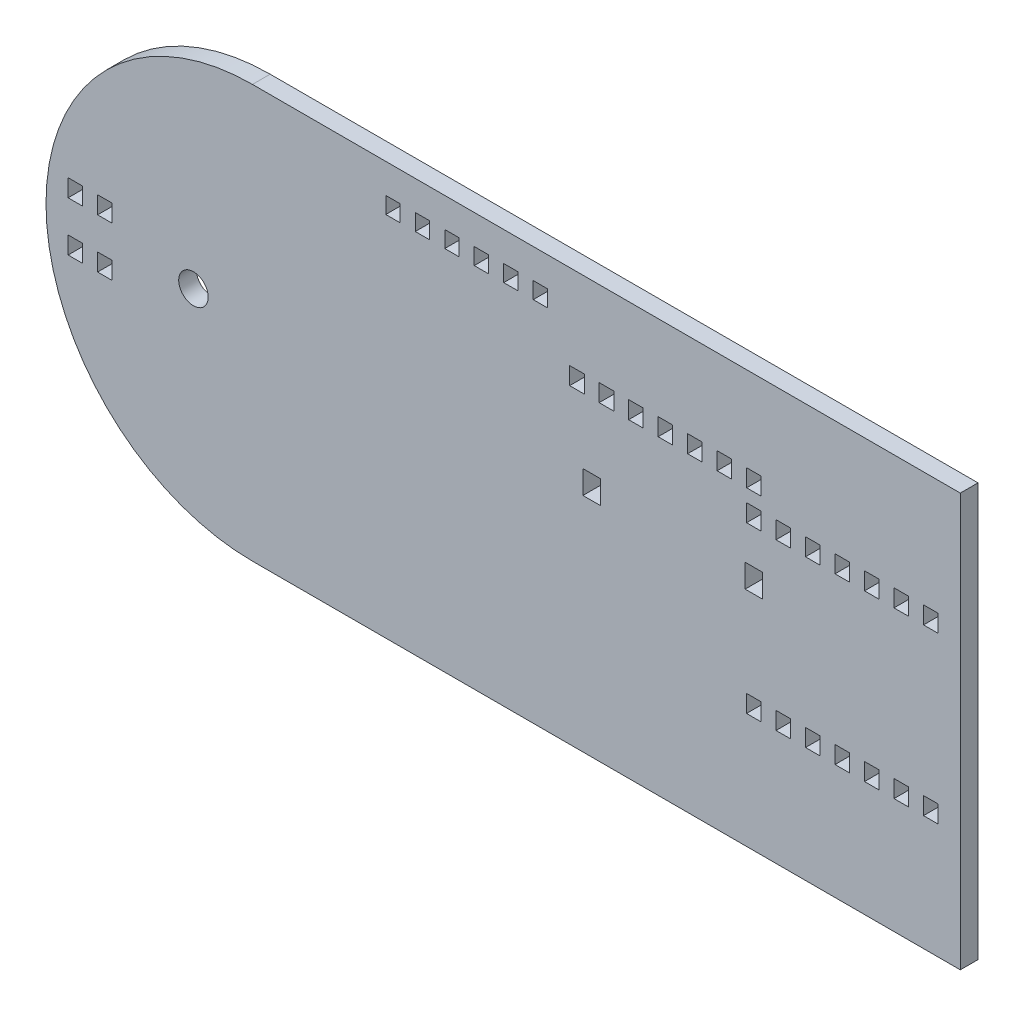
from build123d import *

# Parameters (mm, degrees)
ESQUISSE1_W             = 310
ESQUISSE1_H             = 140
BOSS_EXTRU_1_DEPTH      = 6
ESQUISSE4_W             = 4.95
ESQUISSE4_H             = 5.9
ESQUISSE4_W_2           = 5.9
ESQUISSE4_H_2           = 7.9
ENL_V_MAT_EXTRU_3_DEPTH = 6
ESQUISSE5_W             = 4.95
ESQUISSE5_H             = 5.9
ENL_V_MAT_EXTRU_4_DEPTH = 6
ESQUISSE6_W             = 4.95
ESQUISSE6_H             = 5.9
ENL_V_MAT_EXTRU_5_DEPTH = 6
ENL_V_MAT_EXTRU_6_DEPTH = 6
ESQUISSE8_R             = 5
ENL_V_MAT_EXTRU_7_DEPTH = 6
ESQUISSE9_W             = 4.8
ESQUISSE9_H             = 5.6
ENL_V_MAT_EXTRU_8_DEPTH = 10


with BuildPart() as part:
    # Esquisse1 → Boss.-Extru.1 (new body)
    with BuildSketch(Plane.XY):
        with Locations((155, 70)):
            Rectangle(ESQUISSE1_W, ESQUISSE1_H)
    extrude(amount=BOSS_EXTRU_1_DEPTH)

    # Esquisse4 → Enlèv. mat.-Extru.3 (cut)
    with BuildSketch(Plane.XY.offset(6)):
        with Locations((190.025, 108.27)):
            Rectangle(ESQUISSE4_W, ESQUISSE4_H)
        with Locations((185, 79.27)):
            Rectangle(ESQUISSE4_W_2, ESQUISSE4_H_2)
        with Locations((240, 79.27)):
            Rectangle(ESQUISSE4_W_2, ESQUISSE4_H_2)
        with Locations((180.025, 108.27)):
            Rectangle(ESQUISSE4_W, ESQUISSE4_H)
        with Locations((200.025, 108.27)):
            Rectangle(ESQUISSE4_W, ESQUISSE4_H)
        with Locations((210.025, 108.27)):
            Rectangle(ESQUISSE4_W, ESQUISSE4_H)
        with Locations((220.025, 108.27)):
            Rectangle(ESQUISSE4_W, ESQUISSE4_H)
        with Locations((230.025, 108.27)):
            Rectangle(ESQUISSE4_W, ESQUISSE4_H)
        with Locations((240.025, 108.27)):
            Rectangle(ESQUISSE4_W, ESQUISSE4_H)
    extrude(amount=-ENL_V_MAT_EXTRU_3_DEPTH, mode=Mode.SUBTRACT)

    # Esquisse5 → Enlèv. mat.-Extru.4 (cut)
    with BuildSketch(Plane(origin=(0, 0, 0), x_dir=(-1, 0, 0), z_dir=(0, 0, -1))):
        with Locations((-300, 98)):
            Rectangle(ESQUISSE5_W, ESQUISSE5_H)
        with Locations((-290, 98)):
            Rectangle(ESQUISSE5_W, ESQUISSE5_H)
        with Locations((-280, 98)):
            Rectangle(ESQUISSE5_W, ESQUISSE5_H)
        with Locations((-270, 98)):
            Rectangle(ESQUISSE5_W, ESQUISSE5_H)
        with Locations((-260, 98)):
            Rectangle(ESQUISSE5_W, ESQUISSE5_H)
        with Locations((-250, 98)):
            Rectangle(ESQUISSE5_W, ESQUISSE5_H)
        with Locations((-240, 98)):
            Rectangle(ESQUISSE5_W, ESQUISSE5_H)
        with Locations((-240, 42)):
            Rectangle(ESQUISSE5_W, ESQUISSE5_H)
        with Locations((-250, 42)):
            Rectangle(ESQUISSE5_W, ESQUISSE5_H)
        with Locations((-260, 42)):
            Rectangle(ESQUISSE5_W, ESQUISSE5_H)
        with Locations((-270, 42)):
            Rectangle(ESQUISSE5_W, ESQUISSE5_H)
        with Locations((-280, 42)):
            Rectangle(ESQUISSE5_W, ESQUISSE5_H)
        with Locations((-300, 42)):
            Rectangle(ESQUISSE5_W, ESQUISSE5_H)
        with Locations((-290, 42)):
            Rectangle(ESQUISSE5_W, ESQUISSE5_H)
    extrude(amount=-ENL_V_MAT_EXTRU_4_DEPTH, mode=Mode.SUBTRACT)

    # Esquisse6 → Enlèv. mat.-Extru.5 (cut)
    with BuildSketch(Plane(origin=(0, 0, 0), x_dir=(-1, 0, 0), z_dir=(0, 0, -1))):
        with Locations((-9.975, 78.4)):
            Rectangle(ESQUISSE6_W, ESQUISSE6_H)
        with Locations((-19.975, 78.4)):
            Rectangle(ESQUISSE6_W, ESQUISSE6_H)
        with Locations((-9.975, 61.6)):
            Rectangle(ESQUISSE6_W, ESQUISSE6_H)
        with Locations((-19.975, 61.6)):
            Rectangle(ESQUISSE6_W, ESQUISSE6_H)
    extrude(amount=-ENL_V_MAT_EXTRU_5_DEPTH, mode=Mode.SUBTRACT)

    # Esquisse7 → Enlèv. mat.-Extru.6 (cut)
    with BuildSketch(Plane(origin=(0, 0, 0), x_dir=(-1, 0, 0), z_dir=(0, 0, -1))):
        with BuildLine():
            Line((-70, 140), (0, 140))
            Line((0, 140), (30, 140))
            Line((30, 140), (30, 0))
            Line((30, 0), (0, 0))
            Line((0, 0), (-70, 0))
            ThreePointArc((-70, 0), (0, 70), (-70, 140))
        make_face()
    extrude(amount=-ENL_V_MAT_EXTRU_6_DEPTH, mode=Mode.SUBTRACT)

    # Esquisse8 → Enlèv. mat.-Extru.7 (cut)
    with BuildSketch(Plane.XY.offset(6)):
        with Locations((50, 70)):
            Circle(ESQUISSE8_R)
    extrude(amount=-ENL_V_MAT_EXTRU_7_DEPTH, mode=Mode.SUBTRACT)

    # Esquisse9 → Enlèv. mat.-Extru.8 (cut)
    with BuildSketch(Plane.XY.offset(6)):
        with Locations((117.6, 127.2)):
            Rectangle(ESQUISSE9_W, ESQUISSE9_H)
        with Locations((127.6, 127.2)):
            Rectangle(ESQUISSE9_W, ESQUISSE9_H)
        with Locations((137.6, 127.2)):
            Rectangle(ESQUISSE9_W, ESQUISSE9_H)
        with Locations((147.6, 127.2)):
            Rectangle(ESQUISSE9_W, ESQUISSE9_H)
        with Locations((157.6, 127.2)):
            Rectangle(ESQUISSE9_W, ESQUISSE9_H)
        with Locations((167.6, 127.2)):
            Rectangle(ESQUISSE9_W, ESQUISSE9_H)
    extrude(amount=-ENL_V_MAT_EXTRU_8_DEPTH, mode=Mode.SUBTRACT)


solid = part.part
